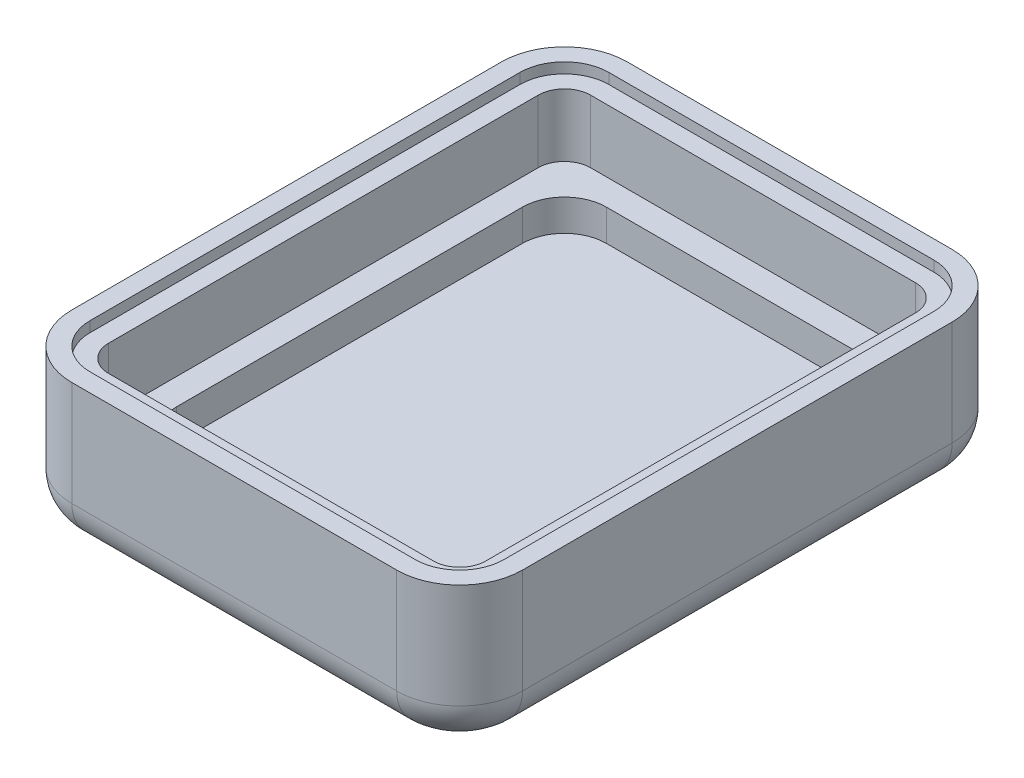
from build123d import *

# Parameters (mm, degrees)
BOSS_EXTRUDE1_DEPTH = 2
BOSS_EXTRUDE2_DEPTH = 5
BOSS_EXTRUDE3_DEPTH = 1.5
FILLET1_R           = 2
CUT_EXTRUDE1_DEPTH  = 0.5


with BuildPart() as part:
    # Sketch1 → Boss-Extrude1 (new body)
    with BuildSketch(Plane(origin=(0, 0, 0), x_dir=(1, 0, 0), z_dir=(0, 1, 0))):
        with BuildLine():
            Line((-7.75, -13.25), (7.75, -13.25))
            ThreePointArc((7.75, -13.25), (9.871320344, -12.371320344), (10.75, -10.25))
            Line((10.75, -10.25), (10.75, 10.25))
            ThreePointArc((10.75, 10.25), (9.871320344, 12.371320344), (7.75, 13.25))
            Line((7.75, 13.25), (-7.75, 13.25))
            ThreePointArc((-7.75, 13.25), (-9.871320344, 12.371320344), (-10.75, 10.25))
            Line((-10.75, 10.25), (-10.75, -10.25))
            ThreePointArc((-10.75, -10.25), (-9.871320344, -12.371320344), (-7.75, -13.25))
        make_face()
    extrude(amount=BOSS_EXTRUDE1_DEPTH)

    # Sketch2 → Boss-Extrude2 (add)
    with BuildSketch(Plane(origin=(0, 2, 0), x_dir=(1, 0, 0), z_dir=(0, 1, 0))):
        with BuildLine():
            Line((-7.75, -13.25), (7.75, -13.25))
            ThreePointArc((7.75, -13.25), (9.871320344, -12.371320344), (10.75, -10.25))
            Line((10.75, -10.25), (10.75, 10.25))
            ThreePointArc((10.75, 10.25), (9.871320344, 12.371320344), (7.75, 13.25))
            Line((7.75, 13.25), (-7.75, 13.25))
            ThreePointArc((-7.75, 13.25), (-9.871320344, 12.371320344), (-10.75, 10.25))
            Line((-10.75, 10.25), (-10.75, -10.25))
            ThreePointArc((-10.75, -10.25), (-9.871320344, -12.371320344), (-7.75, -13.25))
        make_face()
        with BuildLine():
            Line((-7.75, -11.5), (7.75, -11.5))
            ThreePointArc((7.75, -11.5), (8.633883476, -11.133883476), (9, -10.25))
            Line((9, -10.25), (9, 10.25))
            ThreePointArc((9, 10.25), (8.633883476, 11.133883476), (7.75, 11.5))
            Line((7.75, 11.5), (-7.75, 11.5))
            ThreePointArc((-7.75, 11.5), (-8.633883476, 11.133883476), (-9, 10.25))
            Line((-9, 10.25), (-9, -10.25))
            ThreePointArc((-9, -10.25), (-8.633883476, -11.133883476), (-7.75, -11.5))
        make_face(mode=Mode.SUBTRACT)
    extrude(amount=BOSS_EXTRUDE2_DEPTH)

    # Sketch3 → Boss-Extrude3 (add)
    with BuildSketch(Plane(origin=(0, 2, 0), x_dir=(1, 0, 0), z_dir=(0, 1, 0))):
        with BuildLine():
            Line((9, -10.25), (-5.75, -10.25))
            ThreePointArc((-5.75, -10.25), (-7.164213562, -9.664213562), (-7.75, -8.25))
            Line((-7.75, -8.25), (-7.75, 8.25))
            ThreePointArc((-7.75, 8.25), (-7.164213562, 9.664213562), (-5.75, 10.25))
            Line((-5.75, 10.25), (9, 10.25))
            Line((9, 10.25), (9, 12.25))
            Line((9, 12.25), (-9.75, 12.25))
            Line((-9.75, 12.25), (-9.75, -12.25))
            Line((-9.75, -12.25), (9, -12.25))
            Line((9, -12.25), (9, -10.25))
        make_face()
    extrude(amount=BOSS_EXTRUDE3_DEPTH)

    # Fillet1
    fillet1_edges = [part.edges().sort_by_distance(p)[0] for p in [
        (0, 0, 13.25),
        (-9.871320344, 0, 12.371320344),
        (-10.75, 0, 0),
        (-9.871320344, 0, -12.371320344),
        (0, 0, -13.25),
        (9.871320344, 0, -12.371320344),
        (10.75, 0, 0),
        (9.871320344, 0, 12.371320344),
    ]]
    fillet(fillet1_edges, radius=FILLET1_R)

    # Sketch4 → Cut-Extrude1 (cut)
    with BuildSketch(Plane(origin=(0, 7, 0), x_dir=(1, 0, 0), z_dir=(0, 1, 0))):
        with BuildLine():
            Line((-7.75, 12.375), (7.75, 12.375))
            ThreePointArc((7.75, 12.375), (9.25260191, 11.75260191), (9.875, 10.25))
            Line((9.875, 10.25), (9.875, -10.25))
            ThreePointArc((9.875, -10.25), (9.25260191, -11.75260191), (7.75, -12.375))
            Line((7.75, -12.375), (-7.75, -12.375))
            ThreePointArc((-7.75, -12.375), (-9.25260191, -11.75260191), (-9.875, -10.25))
            Line((-9.875, -10.25), (-9.875, 10.25))
            ThreePointArc((-9.875, 10.25), (-9.25260191, 11.75260191), (-7.75, 12.375))
        make_face()
    extrude(amount=-CUT_EXTRUDE1_DEPTH, mode=Mode.SUBTRACT)


solid = part.part
